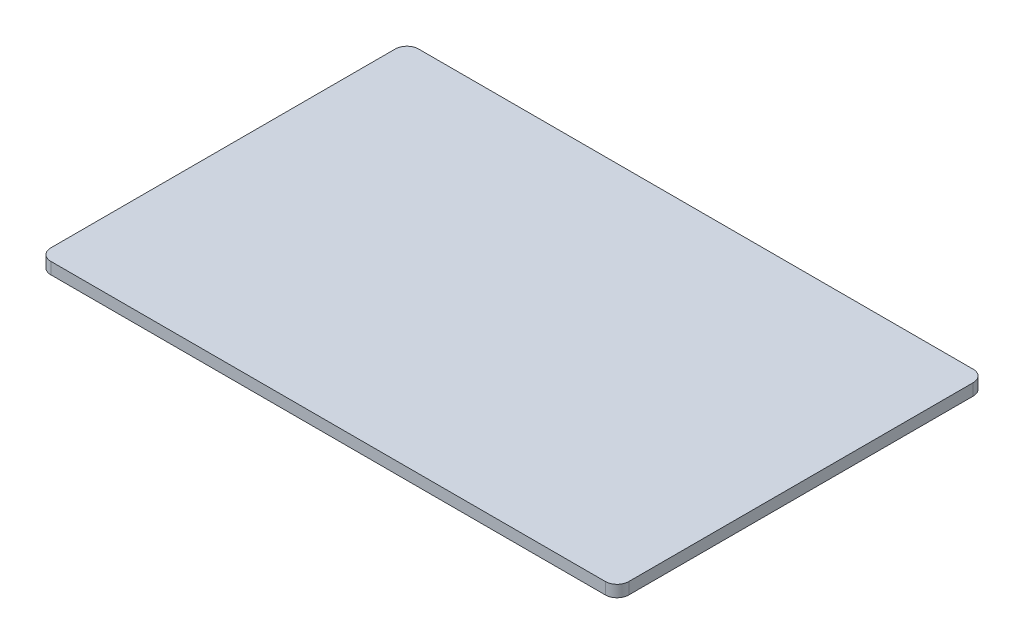
from build123d import *

# Parameters (mm, degrees)
SKETCH1_W           = 99
SKETCH1_H           = 63
BOSS_EXTRUDE1_DEPTH = 2
FILLET1_R           = 2


with BuildPart() as part:
    # Sketch1 → Boss-Extrude1 (new body)
    with BuildSketch(Plane(origin=(0, 0, 0), x_dir=(1, 0, 0), z_dir=(0, 1, 0))):
        Rectangle(SKETCH1_W, SKETCH1_H)
    extrude(amount=BOSS_EXTRUDE1_DEPTH)

    # Fillet1
    fillet1_edges = [part.edges().sort_by_distance(p)[0] for p in [
        (-49.5, 1, -31.5),
        (49.5, 1, -31.5),
        (49.5, 1, 31.5),
        (-49.5, 1, 31.5),
    ]]
    fillet(fillet1_edges, radius=FILLET1_R)


solid = part.part
